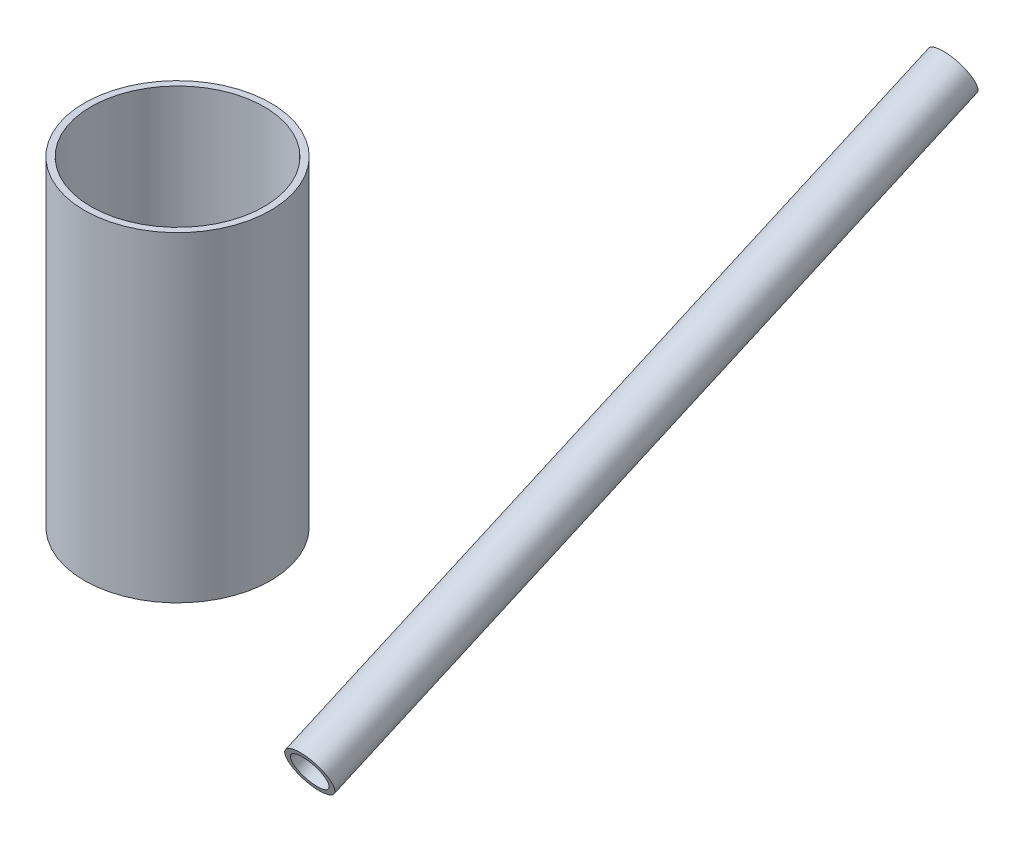
from build123d import *

# Parameters (mm, degrees)
SKETCH16_R                                   = 12.7
SKETCH16_R_2                                 = 11.811
WELD_TUBING_1_00_X_0_035_AS_MACHINED_1_DEPTH = 43.729243763
SKETCH114_R                                  = 3.175
SKETCH114_R_2                                = 2.4638
WELD_TUBING_0_250_X_0_028_1_DEPTH            = 95.983175293


with BuildPart() as part:
    # Sketch16 → Weld tubing 1.00 X 0.035<AS MACHINED>(1) (new body)
    with BuildSketch(Plane(origin=(-56.579503991, -3.740001111, 0), x_dir=(-1, 0, 0), z_dir=(0, 1, 0))):
        Circle(SKETCH16_R)
        Circle(SKETCH16_R_2, mode=Mode.SUBTRACT)
    extrude(amount=WELD_TUBING_1_00_X_0_035_AS_MACHINED_1_DEPTH)


with BuildPart() as body_2:
    # Sketch114 → Weld tubing 0.250 X 0.028(1) (new body)
    with BuildSketch(Plane(origin=(0, 14.908126973, 38.544777524), x_dir=(0, 0.9138115486202572, 0.4061384660534476), z_dir=(0, 0.4061384660534476, -0.9138115486202572))):
        Circle(SKETCH114_R)
        Circle(SKETCH114_R_2, mode=Mode.SUBTRACT)
    extrude(amount=WELD_TUBING_0_250_X_0_028_1_DEPTH)


solid = Compound([part.part, body_2.part])
